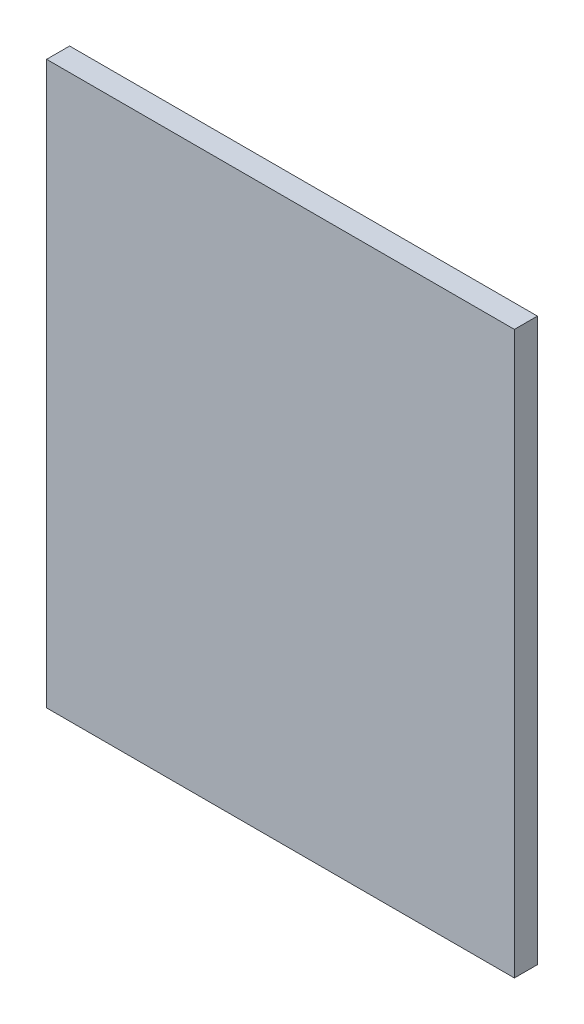
from build123d import *

# Parameters (mm, degrees)
ESQUISSE2_W        = 101.6
ESQUISSE2_H        = 122
BOSS_EXTRU_1_DEPTH = 5


with BuildPart() as part:
    # Esquisse2 → Boss.-Extru.1 (new body)
    with BuildSketch(Plane.XY):
        with Locations((50.8, 61)):
            Rectangle(ESQUISSE2_W, ESQUISSE2_H)
    extrude(amount=BOSS_EXTRU_1_DEPTH)


solid = part.part
